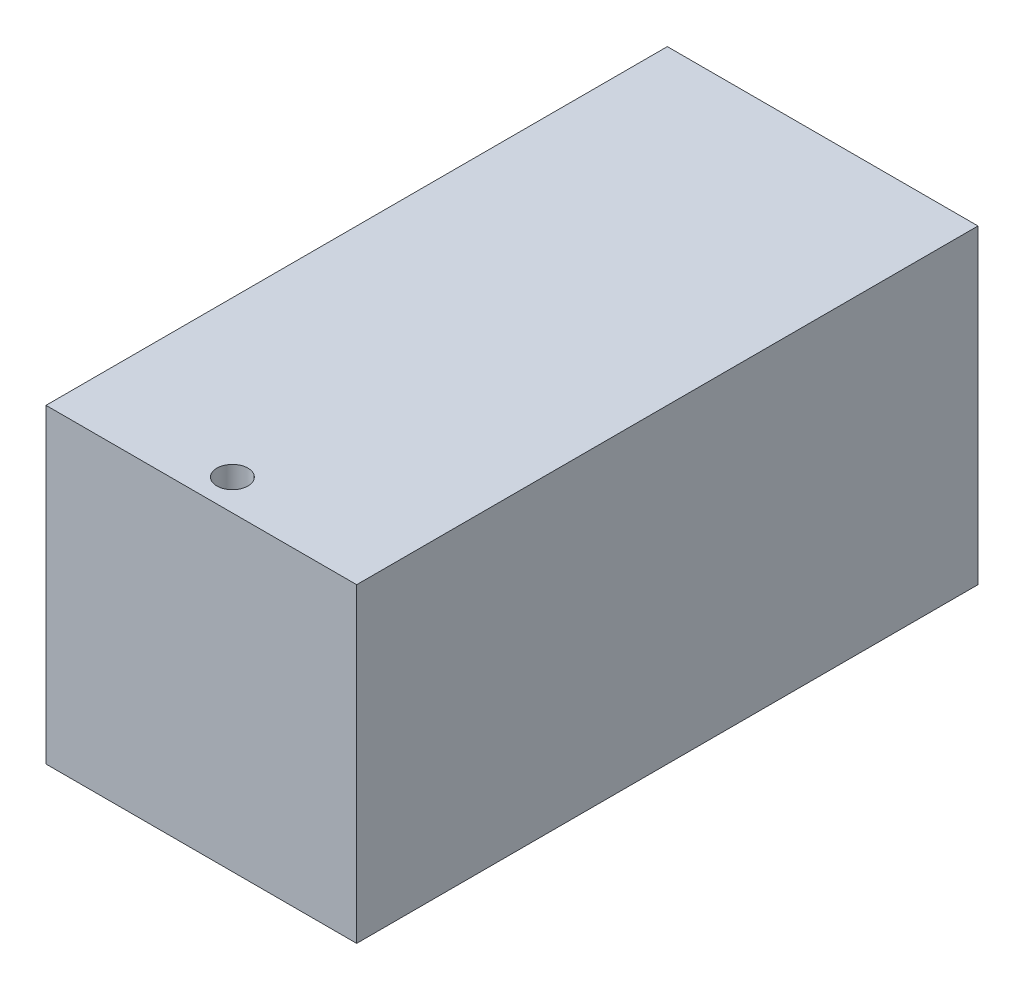
from build123d import *

# Parameters (mm, degrees)
SKETCH1_W           = 50
SKETCH1_H           = 50
BOSS_EXTRUDE1_DEPTH = 100
SKETCH2_R           = 2.5
CUT_EXTRUDE1_DEPTH  = 123.474487139


with BuildPart() as part:
    # Sketch1 → Boss-Extrude1 (new body)
    with BuildSketch(Plane.XY):
        with Locations((25, -25)):
            Rectangle(SKETCH1_W, SKETCH1_H)
    extrude(amount=BOSS_EXTRUDE1_DEPTH)

    # Sketch2 → Cut-Extrude1 (cut, through all)
    with BuildSketch(Plane(origin=(0, 0, 0), x_dir=(1, 0, 0), z_dir=(0, 1, 0))):
        with Locations(Location((25, -95, 0), (0, 0, 270))):
            Circle(SKETCH2_R)
    extrude(amount=-CUT_EXTRUDE1_DEPTH, mode=Mode.SUBTRACT)


solid = part.part
